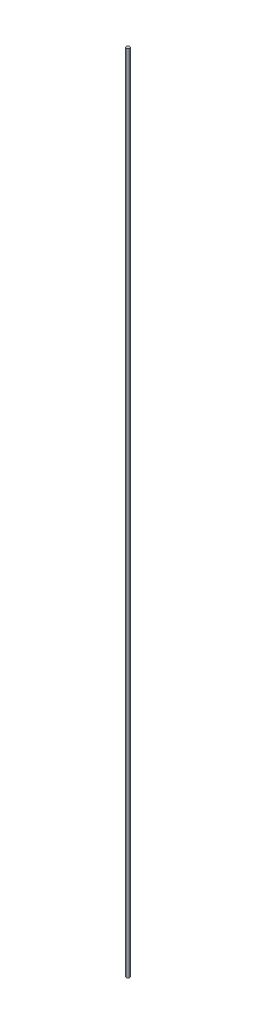
from build123d import *

# Parameters (mm, degrees)
SKETCH1_R           = 0.762
BOSS_EXTRUDE1_DEPTH = 381


with BuildPart() as part:
    # Sketch1 → Boss-Extrude1 (new body)
    with BuildSketch(Plane(origin=(0, 0, 0), x_dir=(1, 0, 0), z_dir=(0, 1, 0))):
        with Locations(Location((0, 0, 0), (0, 0, 270))):
            Circle(SKETCH1_R)
    extrude(amount=BOSS_EXTRUDE1_DEPTH)


solid = part.part
